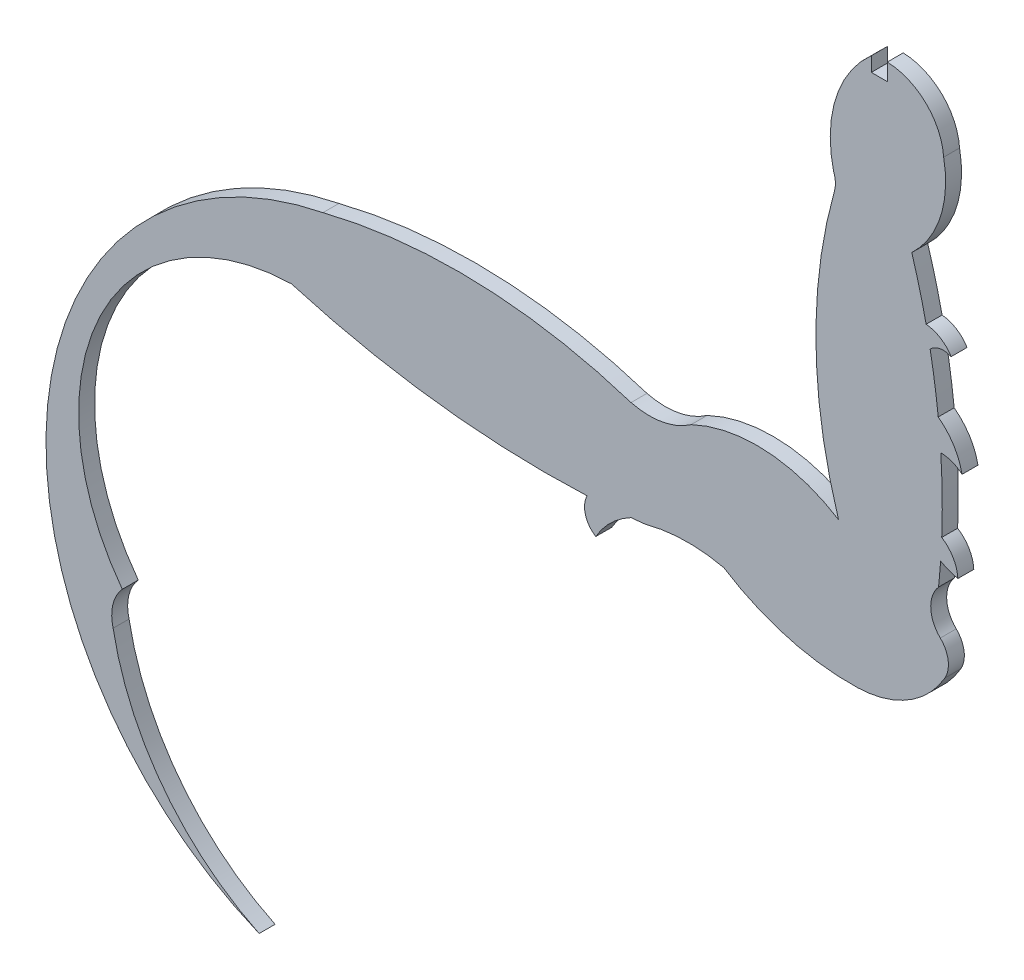
from build123d import *

# Parameters (mm, degrees)
BOSS_EXTRUDE1_DEPTH = 1.524


with BuildPart() as part:
    # Sketch1 → Boss-Extrude1 (new body)
    with BuildSketch(Plane.XY):
        with BuildLine():
            Line((-1.524, 93.996264428), (0, 93.996264428))
            Line((0, 93.996264428), (0, 95.614927588))
            ThreePointArc((0, 95.614927588), (3.693748092, 94.060684173), (5.394313408, 90.431975702))
            ThreePointArc((5.394313408, 90.431975702), (5.083870366, 85.328096728), (2.344513216, 81.010472628))
            ThreePointArc((2.344513216, 81.010472628), (3.08526248, 78.397508533), (3.719210033, 75.756599345))
            ThreePointArc((3.719210033, 75.756599345), (5.090797567, 75.29470873), (6.107013429, 74.264223104))
            ThreePointArc((6.107013429, 74.264223104), (5.043110614, 74.395683401), (4.100454534, 73.885222311))
            ThreePointArc((4.100454534, 73.885222311), (4.539807281, 71.277090284), (4.875594315, 68.653613474))
            ThreePointArc((4.875594315, 68.653613474), (6.349854496, 67.059002397), (7.15480331, 65.042003395))
            ThreePointArc((7.15480331, 65.042003395), (6.204169614, 65.603166167), (5.120829927, 65.815258603))
            ThreePointArc((5.120829927, 65.815258603), (5.25598444, 62.33072683), (5.209157654, 58.843889342))
            ThreePointArc((5.209157654, 58.843889342), (6.301599024, 57.713807832), (6.751402544, 56.207756982))
            ThreePointArc((6.751402544, 56.207756982), (5.901509406, 56.458638265), (5.099422344, 56.835355808))
            ThreePointArc((5.099422344, 56.835355808), (5.010976532, 55.705411647), (4.903376867, 54.577130307))
            ThreePointArc((4.903376867, 54.577130307), (4.160208316, 52.476052404), (5.072854771, 50.442851897))
            ThreePointArc((5.072854771, 50.442851897), (5.82334848, 48.971843275), (5.510783631, 47.350297597))
            ThreePointArc((5.510783631, 47.350297597), (1.996073925, 43.775155466), (-2.817678827, 42.374223627))
            ThreePointArc((-2.817678827, 42.374223627), (-9.49417325, 43.186036631), (-15.638900273, 45.92043747))
            ThreePointArc((-15.638900273, 45.92043747), (-19.39296862, 46.30049438), (-23.12808354, 45.765341186))
            ThreePointArc((-23.12808354, 45.765341186), (-23.817150151, 45.692245813), (-24.506779764, 45.624668263))
            ThreePointArc((-24.506779764, 45.624668263), (-26.42654707, 44.241801226), (-27.879124662, 42.374223627))
            ThreePointArc((-27.879124662, 42.374223627), (-28.871257944, 43.69170684), (-28.707753031, 45.332851748))
            ThreePointArc((-28.707753031, 45.332851748), (-42.992230857, 45.870590172), (-56.993482586, 48.751635021))
            ThreePointArc((-56.993482586, 48.751635021), (-75.256918565, 36.987495898), (-73.1639091, 15.364189619))
            ThreePointArc((-73.1639091, 15.364189619), (-74.068740922, 13.643348437), (-74.042155454, 11.699304143))
            ThreePointArc((-74.042155454, 11.699304143), (-69.240477752, 0.882449229), (-60.077247453, -6.607255003))
            ThreePointArc((-60.077247453, -6.607255003), (-80.312075554, 27.040950348), (-53.970648666, 56.157598868))
            ThreePointArc((-53.970648666, 56.157598868), (-39.168269925, 57.733871806), (-24.506779764, 55.157875102))
            ThreePointArc((-24.506779764, 55.157875102), (-21.512905256, 55.048508832), (-18.750408328, 56.207756982))
            ThreePointArc((-18.750408328, 56.207756982), (-11.598379652, 57.610020261), (-4.659613728, 55.380360214))
            ThreePointArc((-4.659613728, 55.380360214), (-6.824036174, 68.85301684), (-5.055416365, 82.38332301))
            ThreePointArc((-5.055416365, 82.38332301), (-4.963334277, 83.197390982), (-5.135176923, 83.998425237))
            ThreePointArc((-5.135176923, 83.998425237), (-4.912918532, 90.191927066), (-1.524, 95.380770374))
            Line((-1.524, 95.380770374), (-1.524, 93.996264428))
        make_face()
    extrude(amount=BOSS_EXTRUDE1_DEPTH)


solid = part.part
